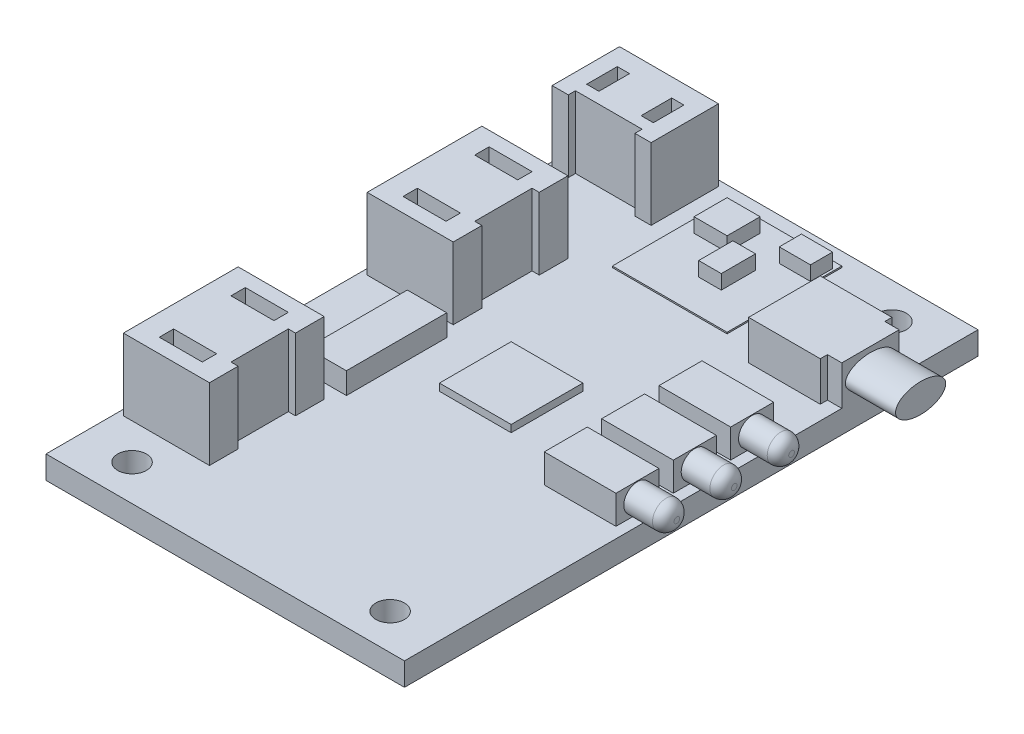
from build123d import *

# Parameters (mm, degrees)
SKETCH1_W              = 25
SKETCH1_H              = 40
BOSS_EXTRUDE1_DEPTH    = 1.6
SKETCH2_W              = 5
SKETCH2_H              = 5
BOSS_EXTRUDE2_DEPTH    = 0.5
SKETCH3_W              = 5
SKETCH3_H              = 3
BOSS_EXTRUDE3_DEPTH    = 2
SKETCH4_R              = 0.95
BOSS_EXTRUDE6_DEPTH    = 2.75
FILLET2_R              = 0.75
LPATTERN2_COUNT        = 3
LPATTERN2_PITCH        = 4
FILLET2_OF_LPATTERN2_R = 0.75
BOSS_EXTRUDE7_DEPTH    = 2.75
SKETCH6_RX             = 1.75
SKETCH6_RY             = 1
BOSS_EXTRUDE8_DEPTH    = 3.5
SKETCH7_W              = 8
SKETCH7_H              = 8
SKETCH7_W_2            = 2.174963518
SKETCH7_H_2            = 1.544625232
SKETCH7_W_3            = 2.304661065
SKETCH7_H_3            = 2.304661065
SKETCH7_W_4            = 1.577304609
SKETCH7_H_4            = 2.386179735
BOSS_EXTRUDE9_DEPTH    = 0.1
SKETCH8_W              = 2.304661065
SKETCH8_H              = 2.304661065
SKETCH8_W_2            = 1.577304609
SKETCH8_H_2            = 2.386179735
SKETCH8_W_3            = 2.174963518
SKETCH8_H_3            = 1.544625232
BOSS_EXTRUDE10_DEPTH   = 1
SKETCH9_W              = 2.75
SKETCH9_H              = 7
BOSS_EXTRUDE11_DEPTH   = 1.5
SKETCH10_W             = 3
SKETCH10_H             = 1
BOSS_EXTRUDE12_DEPTH   = 5
LPATTERN3_COUNT        = 2
LPATTERN3_PITCH        = 17
SKETCH11_W             = 0.854141563
SKETCH11_H             = 2.134375226
BOSS_EXTRUDE13_DEPTH   = 5
CUT_EXTRUDE1_REACH     = 51.369
SKETCH12_R             = 1


with BuildPart() as part:
    # Sketch1 → Boss-Extrude1 (new body)
    with BuildSketch(Plane(origin=(0, 0, 0), x_dir=(1, 0, 0), z_dir=(0, 1, 0))):
        with Locations((12.5, 20)):
            Rectangle(SKETCH1_W, SKETCH1_H)
    extrude(amount=BOSS_EXTRUDE1_DEPTH)

    # Sketch2 → Boss-Extrude2 (add)
    with BuildSketch(Plane(origin=(0, 1.6, 0), x_dir=(1, 0, 0), z_dir=(0, 1, 0))):
        with Locations((12.441080564, 20)):
            Rectangle(SKETCH2_W, SKETCH2_H)
    extrude(amount=BOSS_EXTRUDE2_DEPTH)

    # Sketch3 → Boss-Extrude3 (add)
    with BuildSketch(Plane(origin=(0, 1.6, 0), x_dir=(1, 0, 0), z_dir=(0, 1, 0))):
        with Locations((21.75, 17)):
            Rectangle(SKETCH3_W, SKETCH3_H)
    boss_extrude3 = extrude(amount=BOSS_EXTRUDE3_DEPTH)

    # Sketch4 → Boss-Extrude6 (add)
    with BuildSketch(Plane(origin=(24.25, 0, 0), x_dir=(0, 0, -1), z_dir=(1, 0, 0))):
        with Locations(Location((17, 2.6, 0), (0, 0, 180))):
            Circle(SKETCH4_R)
    boss_extrude6 = extrude(amount=BOSS_EXTRUDE6_DEPTH)

    # Fillet2
    fillet2_edges = [part.edges().sort_by_distance(p)[0] for p in [
        (27, 2.6, -17.95),
    ]]
    fillet(fillet2_edges, radius=FILLET2_R)

    # LPattern2: Boss-Extrude3, Boss-Extrude6 ×3
    with Locations(*[(0, 0, -i * LPATTERN2_PITCH) for i in range(1, LPATTERN2_COUNT)]):
        add(boss_extrude3)
        add(boss_extrude6)

    # Fillet2 of LPattern2
    fillet2_of_lpattern2_edges = [part.edges().sort_by_distance(p)[0] for p in [
        (27, 2.6, -21.95),
        (27, 2.6, -25.95),
    ]]
    fillet(fillet2_of_lpattern2_edges, radius=FILLET2_OF_LPATTERN2_R)

    # Sketch5 → Boss-Extrude7 (add)
    with BuildSketch(Plane(origin=(0, 1.6, 0), x_dir=(1, 0, 0), z_dir=(0, 1, 0))):
        Polygon((24, 30.5), (24, 30), (19, 30), (19, 35), (24, 35), (24, 34.5), (25, 34.5), (25, 30.5), align=None)
    extrude(amount=BOSS_EXTRUDE7_DEPTH)

    # Sketch6 → Boss-Extrude8 (add)
    with BuildSketch(Plane(origin=(25, 0, 0), x_dir=(0, 0, -1), z_dir=(1, 0, 0))):
        with Locations(Location((32.5, 2.975), (0, 0, 180))):
            Ellipse(SKETCH6_RX, SKETCH6_RY)
    extrude(amount=BOSS_EXTRUDE8_DEPTH)

    # Sketch7 → Boss-Extrude9 (add)
    # profile 1 of 4: a face of its own
    with BuildSketch(Plane(origin=(0, 1.6, 0), x_dir=(1, 0, 0), z_dir=(0, 1, 0))):
        with Locations((12.5, 35)):
            Rectangle(SKETCH7_W, SKETCH7_H)
        with Locations((15.249590998, 37.749590998)):
            Rectangle(SKETCH7_W_2, SKETCH7_H_2, mode=Mode.SUBTRACT)
        with Locations((10.522721618, 36.977278383)):
            Rectangle(SKETCH7_W_3, SKETCH7_H_3, mode=Mode.SUBTRACT)
        with Locations((12.965958092, 34.534041908)):
            Rectangle(SKETCH7_W_4, SKETCH7_H_4, mode=Mode.SUBTRACT)
    # profile 2 of 4: a face of its own
    with BuildSketch(Plane(origin=(0, 1.6, 0), x_dir=(1, 0, 0), z_dir=(0, 1, 0))):
        with Locations((15.249590998, 37.749590998)):
            Rectangle(SKETCH7_W_2, SKETCH7_H_2)
    # profile 3 of 4: a face of its own
    with BuildSketch(Plane(origin=(0, 1.6, 0), x_dir=(1, 0, 0), z_dir=(0, 1, 0))):
        with Locations((10.522721618, 36.977278383)):
            Rectangle(SKETCH7_W_3, SKETCH7_H_3)
    # profile 4 of 4: a face of its own
    with BuildSketch(Plane(origin=(0, 1.6, 0), x_dir=(1, 0, 0), z_dir=(0, 1, 0))):
        with Locations((12.965958092, 34.534041908)):
            Rectangle(SKETCH7_W_4, SKETCH7_H_4)
    extrude(amount=BOSS_EXTRUDE9_DEPTH)

    # Sketch8 → Boss-Extrude10 (add)
    with BuildSketch(Plane(origin=(0, 1.7, 0), x_dir=(1, 0, 0), z_dir=(0, 1, 0))):
        with Locations((10.522721618, 36.977278383)):
            Rectangle(SKETCH8_W, SKETCH8_H)
        with Locations((12.965958092, 34.534041908)):
            Rectangle(SKETCH8_W_2, SKETCH8_H_2)
        with Locations((15.249590998, 37.749590998)):
            Rectangle(SKETCH8_W_3, SKETCH8_H_3)
    extrude(amount=BOSS_EXTRUDE10_DEPTH)

    # Sketch9 → Boss-Extrude11 (add)
    with BuildSketch(Plane(origin=(0, 1.6, 0), x_dir=(1, 0, 0), z_dir=(0, 1, 0))):
        with Locations((5.575, 17.5)):
            Rectangle(SKETCH9_W, SKETCH9_H)
    extrude(amount=BOSS_EXTRUDE11_DEPTH)

    # Sketch10 → Boss-Extrude12 (add)
    with BuildSketch(Plane(origin=(0, 1.6, 0), x_dir=(1, 0, 0), z_dir=(0, 1, 0))):
        Polygon((6.4, 13), (0.4, 13), (0.4, 5), (6.4, 5), (6.4, 7), (5.9, 7), (5.9, 11), (6.4, 11), align=None)
        with Locations((3.4, 11.5)):
            Rectangle(SKETCH10_W, SKETCH10_H, mode=Mode.SUBTRACT)
        with Locations((3.4, 6.5)):
            Rectangle(SKETCH10_W, SKETCH10_H, mode=Mode.SUBTRACT)
    boss_extrude12 = extrude(amount=BOSS_EXTRUDE12_DEPTH)

    # LPattern3: Boss-Extrude12 ×2
    with Locations(*[(0, 0, -i * LPATTERN3_PITCH) for i in range(1, LPATTERN3_COUNT)]):
        add(boss_extrude12)

    # Sketch11 → Boss-Extrude13 (add)
    with BuildSketch(Plane(origin=(0, 1.6, 0), x_dir=(1, 0, 0), z_dir=(0, 1, 0))):
        Polygon((7.3, 39.6), (0.4, 39.6), (0.4, 34.9), (1.524996245, 34.9), (1.524996245, 35.4), (6.175003755, 35.4), (6.175003755, 34.9), (7.3, 34.9), align=None)
        with Locations((5.747932974, 37.25)):
            Rectangle(SKETCH11_W, SKETCH11_H, mode=Mode.SUBTRACT)
        with Locations((1.952067027, 37.25)):
            Rectangle(SKETCH11_W, SKETCH11_H, mode=Mode.SUBTRACT)
    extrude(amount=BOSS_EXTRUDE13_DEPTH)

    # Sketch12 → Cut-Extrude1 (cut, up to next)
    with BuildSketch(Plane(origin=(0, 1.6, 0), x_dir=(1, 0, 0), z_dir=(0, 1, 0)), mode=Mode.PRIVATE) as cut_extrude1_sk1:
        with Locations(Location((3.5, 2.5, 0), (0, 0, 270))):
            Circle(SKETCH12_R)
    cut_extrude1_tool1 = extrude(cut_extrude1_sk1.sketch, amount=-CUT_EXTRUDE1_REACH, mode=Mode.PRIVATE) & part.part
    # Sketch12 → Cut-Extrude1 (cut, up to next)
    with BuildSketch(Plane(origin=(0, 1.6, 0), x_dir=(1, 0, 0), z_dir=(0, 1, 0)), mode=Mode.PRIVATE) as cut_extrude1_sk2:
        with Locations(Location((21.5, 2.5, 0), (0, 0, 270))):
            Circle(SKETCH12_R)
    cut_extrude1_tool2 = extrude(cut_extrude1_sk2.sketch, amount=-CUT_EXTRUDE1_REACH, mode=Mode.PRIVATE) & part.part
    # Sketch12 → Cut-Extrude1 (cut, up to next)
    with BuildSketch(Plane(origin=(0, 1.6, 0), x_dir=(1, 0, 0), z_dir=(0, 1, 0)), mode=Mode.PRIVATE) as cut_extrude1_sk3:
        with Locations(Location((21.5, 37.5, 0), (0, 0, 270))):
            Circle(SKETCH12_R)
    cut_extrude1_tool3 = extrude(cut_extrude1_sk3.sketch, amount=-CUT_EXTRUDE1_REACH, mode=Mode.PRIVATE) & part.part
    add(cut_extrude1_tool1.solids().sort_by_distance((3.5, 1.6, -2.5))[0], mode=Mode.SUBTRACT)
    add(cut_extrude1_tool2.solids().sort_by_distance((21.5, 1.6, -2.5))[0], mode=Mode.SUBTRACT)
    add(cut_extrude1_tool3.solids().sort_by_distance((21.5, 1.6, -37.5))[0], mode=Mode.SUBTRACT)


solid = part.part
